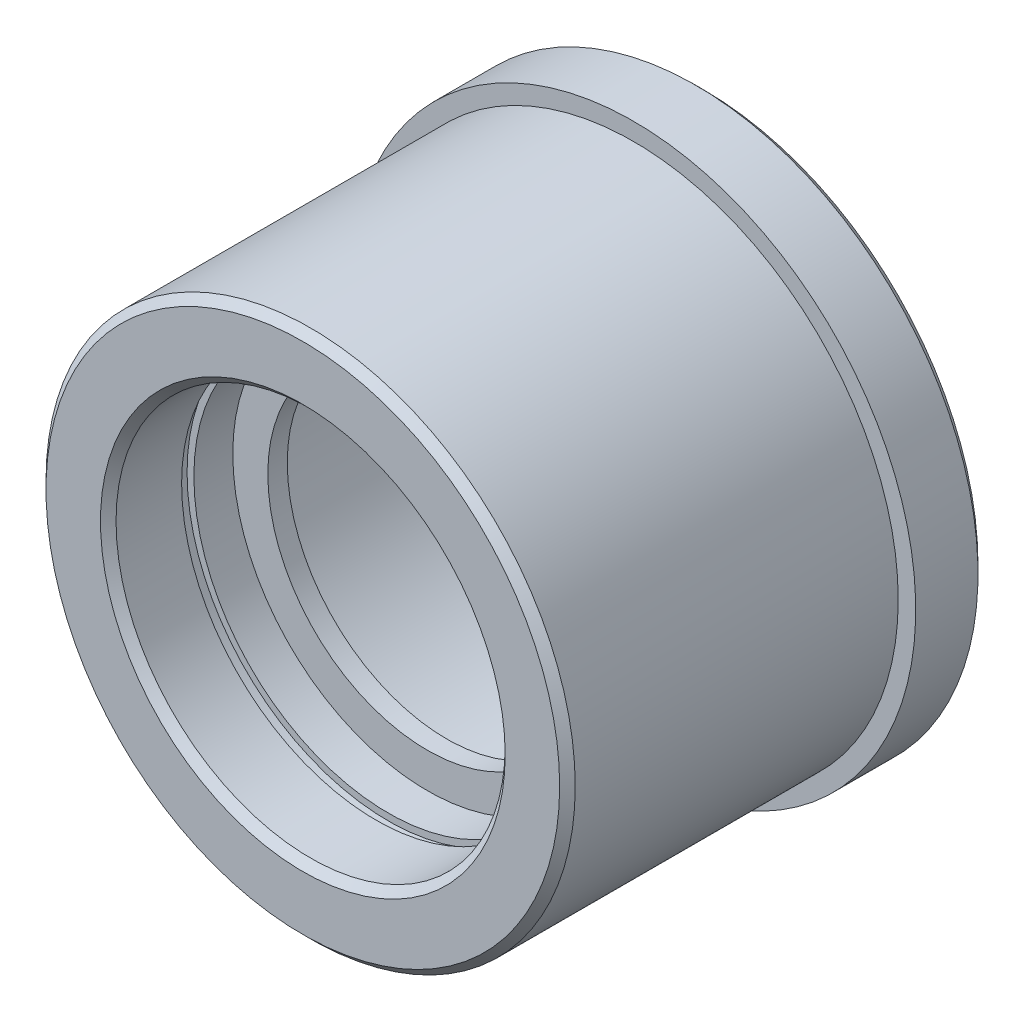
from build123d import *

# Parameters (mm, degrees)
CHAMFER_2_SIZE = 2


with BuildPart() as part:
    # Эскиз1 → Повернуть1 (revolve)
    with BuildSketch(Plane(origin=(0, 0, 0), x_dir=(0, 0, -1), z_dir=(1, 0, 0)), mode=Mode.PRIVATE) as revolve_1_sk:
        Polygon((-84.15, 50), (-103, 50), (-103, 68), (-18, 68), (-18, 72.5), (0, 72.5), (0, 60), (-9.85, 60), (-9.85, 62), (-14, 62), (-14, 60), (-63, 60), (-63, 50), (-66, 50), (-66, 41), (-71, 41), (-71, 50), (-81, 50), (-81, 51.75), (-84.15, 51.75), align=None)
    revolve(revolve_1_sk.sketch.rotate(Axis((0, 0, 0), (0, 0, 1)), 90), axis=Axis((0, 0, 0), (0, 0, 1)))

    # Фаска2
    chamfer_2_edges = [part.edges().sort_by_distance(p)[0] for p in [
        (50, 0, 103),
        (60, 0, 0),
        (72.5, 0, 0),
        (68, 0, 103),
    ]]
    chamfer(chamfer_2_edges, length=CHAMFER_2_SIZE)


solid = part.part
